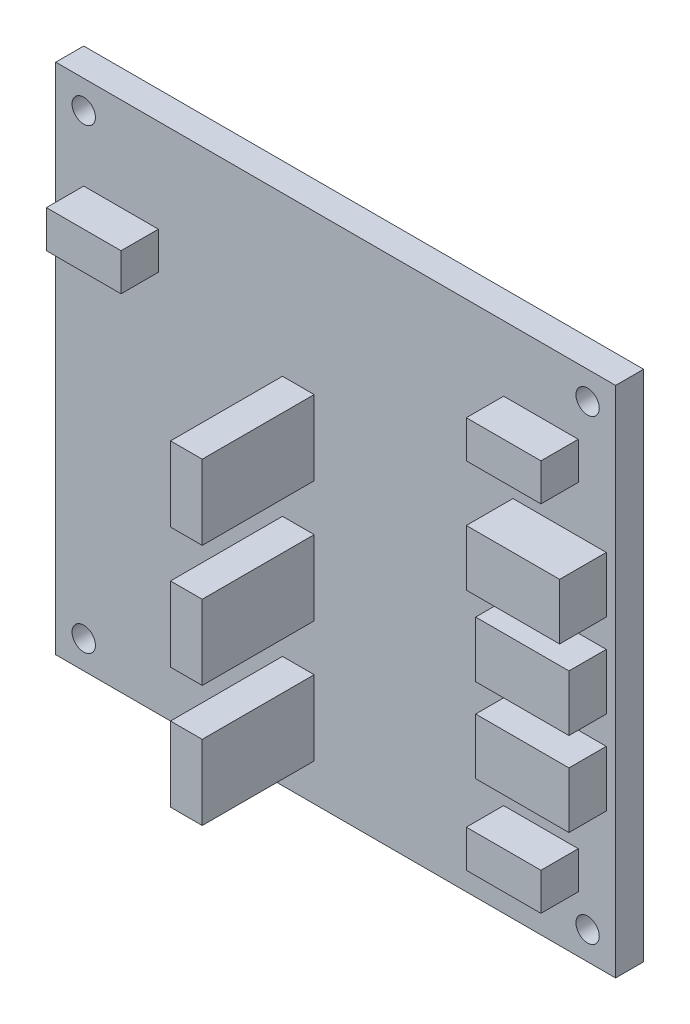
from build123d import *

# Parameters (mm, degrees)
SKETCH1_W           = 76.2
SKETCH1_H           = 69.85
BOSS_EXTRUDE1_DEPTH = 3.81
SKETCH2_R           = 1.5875
CUT_EXTRUDE1_DEPTH  = 104.440700887
SKETCH3_W           = 12.7
SKETCH3_H           = 7.62
BOSS_EXTRUDE2_DEPTH = 6.35
SKETCH3_4_W         = 10.16
SKETCH3_4_H         = 5.08
SKETCH3_4_W_2       = 12.7
SKETCH3_4_H_2       = 7.62
BOSS_EXTRUDE3_DEPTH = 5.08
SKETCH6_W           = 4.318
SKETCH6_H           = 10.16
BOSS_EXTRUDE4_DEPTH = 15.24


with BuildPart() as part:
    # Sketch1 → Boss-Extrude1 (new body)
    with BuildSketch(Plane.XY):
        with Locations((38.1, 34.925)):
            Rectangle(SKETCH1_W, SKETCH1_H)
    extrude(amount=BOSS_EXTRUDE1_DEPTH)

    # Sketch2 → Cut-Extrude1 (cut, through all)
    with BuildSketch(Plane.XY.offset(3.81)):
        with Locations((3.81, 66.04)):
            Circle(SKETCH2_R)
        with Locations((72.39, 66.04)):
            Circle(SKETCH2_R)
        with Locations((72.39, 3.81)):
            Circle(SKETCH2_R)
        with Locations((3.81, 3.81)):
            Circle(SKETCH2_R)
    extrude(amount=-CUT_EXTRUDE1_DEPTH, mode=Mode.SUBTRACT)

    # Sketch3 → Boss-Extrude2 (add)
    with BuildSketch(Plane.XY.offset(3.81)):
        with Locations((68.58, 45.72)):
            Rectangle(SKETCH3_W, SKETCH3_H)
    extrude(amount=BOSS_EXTRUDE2_DEPTH)

    # Sketch3<4> → Boss-Extrude3 (add)
    with BuildSketch(Plane.XY.offset(3.81)):
        with Locations((8.89, 54.61)):
            Rectangle(SKETCH3_4_W, SKETCH3_4_H)
        with Locations((66.04, 58.42)):
            Rectangle(SKETCH3_4_W, SKETCH3_4_H)
        with Locations((68.58, 45.72)):
            Rectangle(SKETCH3_4_W_2, SKETCH3_4_H_2)
        with Locations((68.58, 34.29)):
            Rectangle(SKETCH3_4_W_2, SKETCH3_4_H_2)
        with Locations((68.58, 22.86)):
            Rectangle(SKETCH3_4_W_2, SKETCH3_4_H_2)
        with Locations((66.04, 10.16)):
            Rectangle(SKETCH3_4_W, SKETCH3_4_H)
    extrude(amount=BOSS_EXTRUDE3_DEPTH)

    # Sketch6 → Boss-Extrude4 (add)
    with BuildSketch(Plane.XY.offset(3.81)):
        with Locations((33.02, 43.18)):
            Rectangle(SKETCH6_W, SKETCH6_H)
        with Locations((33.02, 26.67)):
            Rectangle(SKETCH6_W, SKETCH6_H)
        with Locations((33.02, 10.16)):
            Rectangle(SKETCH6_W, SKETCH6_H)
    extrude(amount=BOSS_EXTRUDE4_DEPTH)


solid = part.part
